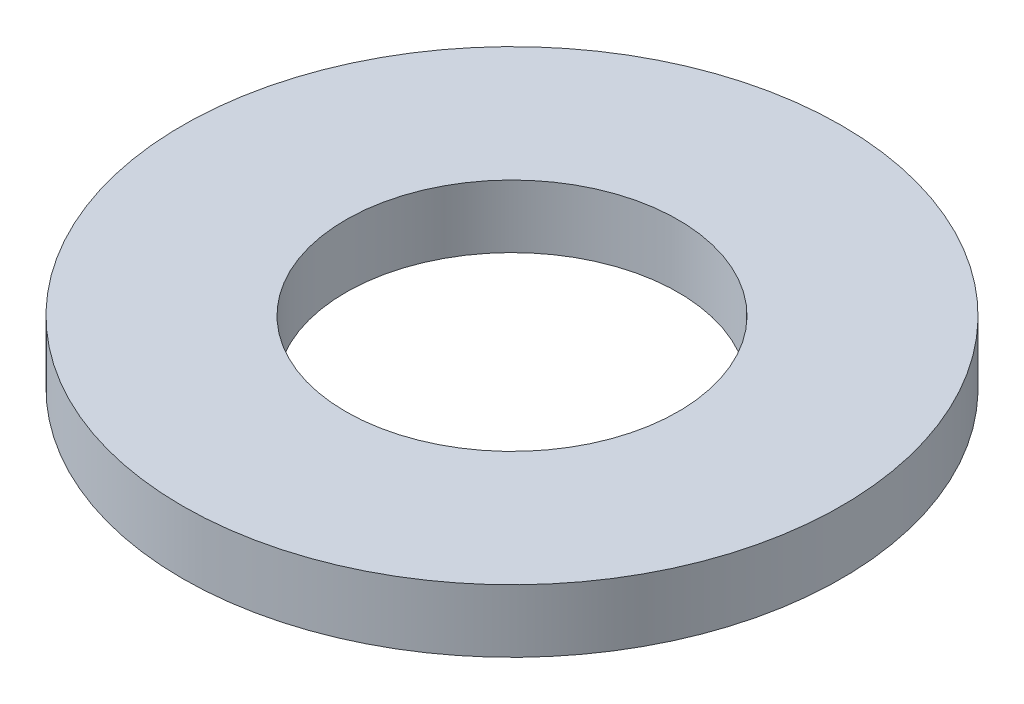
from build123d import *

# Parameters (mm, degrees)
SKETCH1_R           = 8.7884
SKETCH1_R_2         = 4.4323
BOSS_EXTRUDE1_DEPTH = 0.8382


with BuildPart() as part:
    # Sketch1 → Boss-Extrude1 (new, symmetric)
    with BuildSketch(Plane(origin=(0, 0, 0), x_dir=(1, 0, 0), z_dir=(0, 1, 0))):
        with Locations(Location((0, 0, 0), (0, 0, 270))):
            Circle(SKETCH1_R)
        with Locations(Location((0, 0, 0), (0, 0, 270))):
            Circle(SKETCH1_R_2, mode=Mode.SUBTRACT)
    extrude(amount=BOSS_EXTRUDE1_DEPTH, both=True)


solid = part.part
